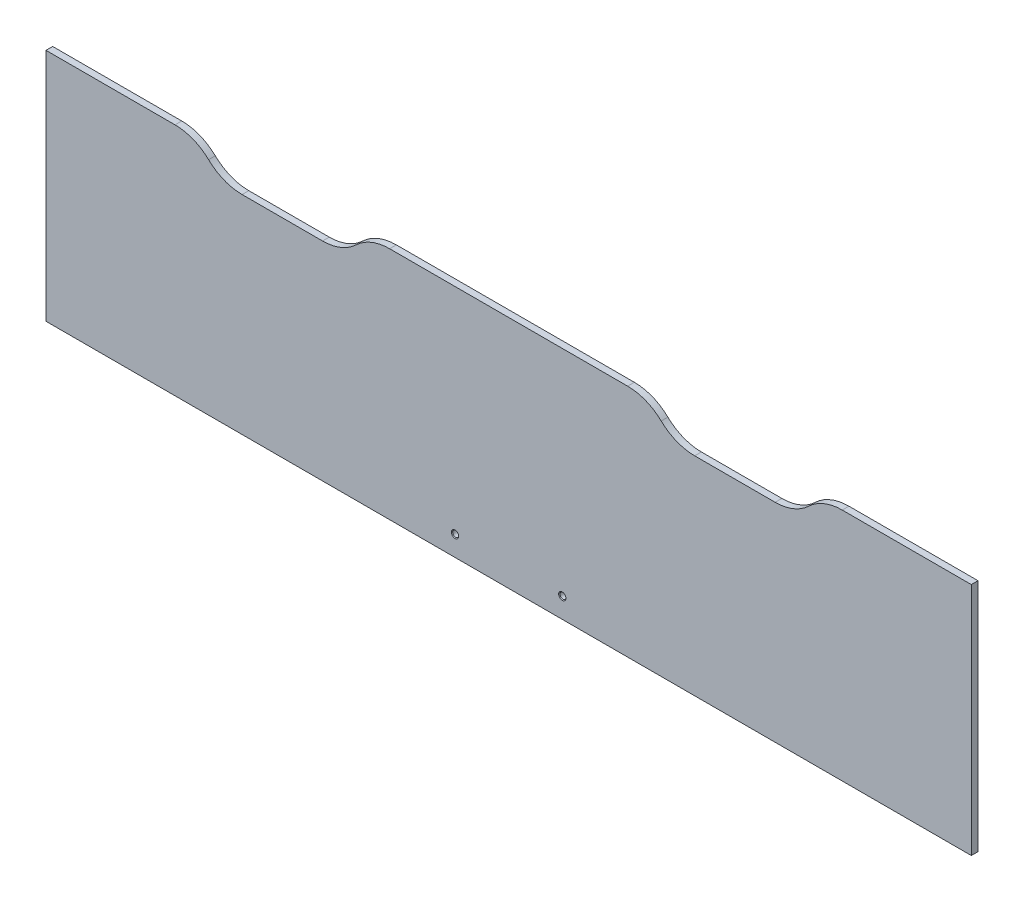
from build123d import *

# Parameters (mm, degrees)
SKETCH1_W                        = 876.3
SKETCH1_H                        = 222.25
BOSS_EXTRUDE1_DEPTH              = 6.35
F_10_CLEARANCE_HOLE1_D           = 5.6134
F_10_CLEARANCE_HOLE1_CSINK_D     = 6.8834
F_10_CLEARANCE_HOLE1_CSINK_ANGLE = 90
CUT_EXTRUDE1_DEPTH               = 492.335738065


with BuildPart() as part:
    # Sketch1 → Boss-Extrude1 (new body)
    with BuildSketch(Plane.XY):
        with Locations((0, 111.125)):
            Rectangle(SKETCH1_W, SKETCH1_H)
    extrude(amount=BOSS_EXTRUDE1_DEPTH)

    # #10 Clearance Hole1 (through all)
    with Locations(Plane.XY.offset(6.35)):
        with Locations((-50.8, 19.05), (50.8, 19.05)):
            CounterSinkHole(F_10_CLEARANCE_HOLE1_D / 2, F_10_CLEARANCE_HOLE1_CSINK_D / 2, counter_sink_angle=F_10_CLEARANCE_HOLE1_CSINK_ANGLE)

    # Sketch5 → Cut-Extrude1 (cut, through all)
    with BuildSketch(Plane.XY.offset(6.35)):
        with BuildLine():
            Line((112.7125, 234.95), (315.9125, 234.95))
            Line((315.9125, 234.95), (315.9125, 222.25))
            ThreePointArc((315.9125, 222.25), (298.814601737, 218.957245657), (284.1625, 209.55))
            ThreePointArc((284.1625, 209.55), (269.510398263, 200.142754343), (252.4125, 196.85))
            Line((252.4125, 196.85), (176.2125, 196.85))
            ThreePointArc((176.2125, 196.85), (159.114601737, 200.142754343), (144.4625, 209.55))
            ThreePointArc((144.4625, 209.55), (129.810398263, 218.957245657), (112.7125, 222.25))
            Line((112.7125, 222.25), (112.7125, 234.95))
        make_face()
    cut_extrude1 = extrude(amount=-CUT_EXTRUDE1_DEPTH, mode=Mode.SUBTRACT)

    # Mirror1: Cut-Extrude1 across plane
    add(cut_extrude1.mirror(Plane(origin=(0, 0, 0), x_dir=(0, 0, 1), z_dir=(1, 0, 0))), mode=Mode.SUBTRACT)


solid = part.part
